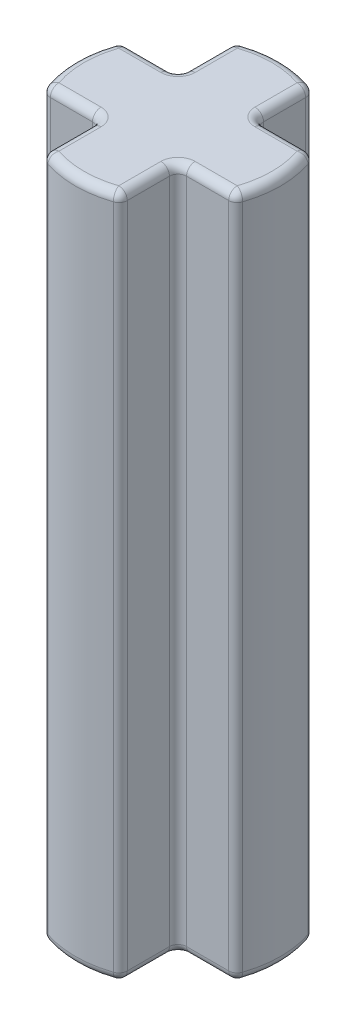
from build123d import *

# Parameters (mm, degrees)
BOSS_EXTRUDE1_DEPTH = 8
FILLET3_R           = 0.2


with BuildPart() as part:
    # Sketch1 → Boss-Extrude1 (new, symmetric)
    with BuildSketch(Plane(origin=(0, 0, 0), x_dir=(1, 0, 0), z_dir=(0, 1, 0))):
        with BuildLine():
            Line((-0.9, -0.9), (-0.9, -2.224859546))
            ThreePointArc((-0.9, -2.224859546), (0, -2.4), (0.9, -2.224859546))
            Line((0.9, -2.224859546), (0.9, -0.9))
            Line((0.9, -0.9), (2.224859546, -0.9))
            ThreePointArc((2.224859546, -0.9), (2.4, 0), (2.224859546, 0.9))
            Line((2.224859546, 0.9), (0.9, 0.9))
            Line((0.9, 0.9), (0.9, 2.224859546))
            ThreePointArc((0.9, 2.224859546), (0, 2.4), (-0.9, 2.224859546))
            Line((-0.9, 2.224859546), (-0.9, 0.9))
            Line((-0.9, 0.9), (-2.224859546, 0.9))
            ThreePointArc((-2.224859546, 0.9), (-2.4, 0), (-2.224859546, -0.9))
            Line((-2.224859546, -0.9), (-0.9, -0.9))
        make_face()
    extrude(amount=BOSS_EXTRUDE1_DEPTH, both=True)

    # Fillet3
    fillet3_edges = [part.edges().sort_by_distance(p)[0] for p in [
        (-1.562429773, -8, -0.9),
        (-0.9, -8, -1.562429773),
        (-0.9, 8, 1.562429773),
        (0, -8, -2.4),
        (0.9, -8, -1.562429773),
        (1.562429773, -8, -0.9),
        (2.4, -8, 0),
        (1.562429773, -8, 0.9),
        (0.9, -8, 1.562429773),
        (0, -8, 2.4),
        (-0.9, -8, 1.562429773),
        (-1.562429773, -8, 0.9),
        (-2.4, -8, 0),
        (0, 8, 2.4),
        (-2.224859546, 0, -0.9),
        (-0.9, 0, -0.9),
        (-0.9, 0, -2.224859546),
        (0.9, 8, 1.562429773),
        (0.9, 0, -2.224859546),
        (0.9, 0, -0.9),
        (2.224859546, 0, -0.9),
        (2.224859546, 0, 0.9),
        (0.9, 0, 0.9),
        (0.9, 0, 2.224859546),
        (-0.9, 0, 2.224859546),
        (-0.9, 0, 0.9),
        (-2.224859546, 0, 0.9),
        (1.562429773, 8, 0.9),
        (2.4, 8, 0),
        (1.562429773, 8, -0.9),
        (0.9, 8, -1.562429773),
        (0, 8, -2.4),
        (-0.9, 8, -1.562429773),
        (-1.562429773, 8, -0.9),
        (-2.4, 8, 0),
        (-1.562429773, 8, 0.9),
    ]]
    fillet(fillet3_edges, radius=FILLET3_R)


solid = part.part
